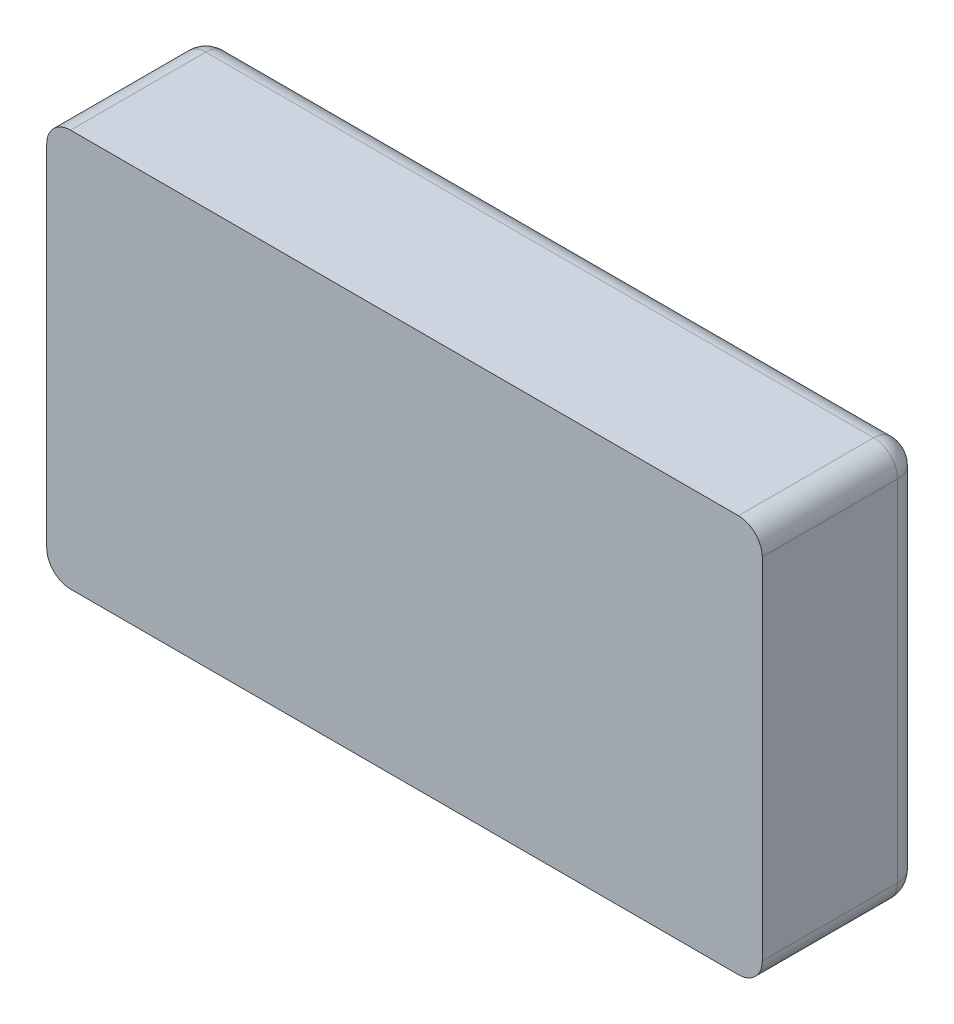
from build123d import *

# Parameters (mm, degrees)
SKETCH1_W           = 9
SKETCH1_H           = 5
BOSS_EXTRUDE1_DEPTH = 2
FILLET7_R           = 0.3
FILLET8_R           = 0.3
FILLET9_R           = 0.3
FILLET10_R          = 0.3


with BuildPart() as part:
    # Sketch1 → Boss-Extrude1 (new body)
    with BuildSketch(Plane.XY):
        with Locations((4.5, -2.5)):
            Rectangle(SKETCH1_W, SKETCH1_H)
    extrude(amount=BOSS_EXTRUDE1_DEPTH)

    # Fillet7
    fillet7_edges = [part.edges().sort_by_distance(p)[0] for p in [
        (0, 0, 1),
    ]]
    fillet(fillet7_edges, radius=FILLET7_R)

    # Fillet8
    fillet8_edges = [part.edges().sort_by_distance(p)[0] for p in [
        (0, -2.65, 0),
        (0.087867966, -0.087867966, 0),
        (4.65, 0, 0),
    ]]
    fillet(fillet8_edges, radius=FILLET8_R)

    # Fillet9
    fillet9_edges = [part.edges().sort_by_distance(p)[0] for p in [
        (9, -0.087867966, 0.087867966),
        (9, -2.65, 0),
        (9, 0, 1.15),
    ]]
    fillet(fillet9_edges, radius=FILLET9_R)

    # Fillet10
    fillet10_edges = [part.edges().sort_by_distance(p)[0] for p in [
        (4.5, -5, 0),
        (0.087867966, -5, 0.087867966),
        (8.912132034, -5, 0.087867966),
        (9, -5, 1.15),
        (0, -5, 1.15),
    ]]
    fillet(fillet10_edges, radius=FILLET10_R)


solid = part.part
